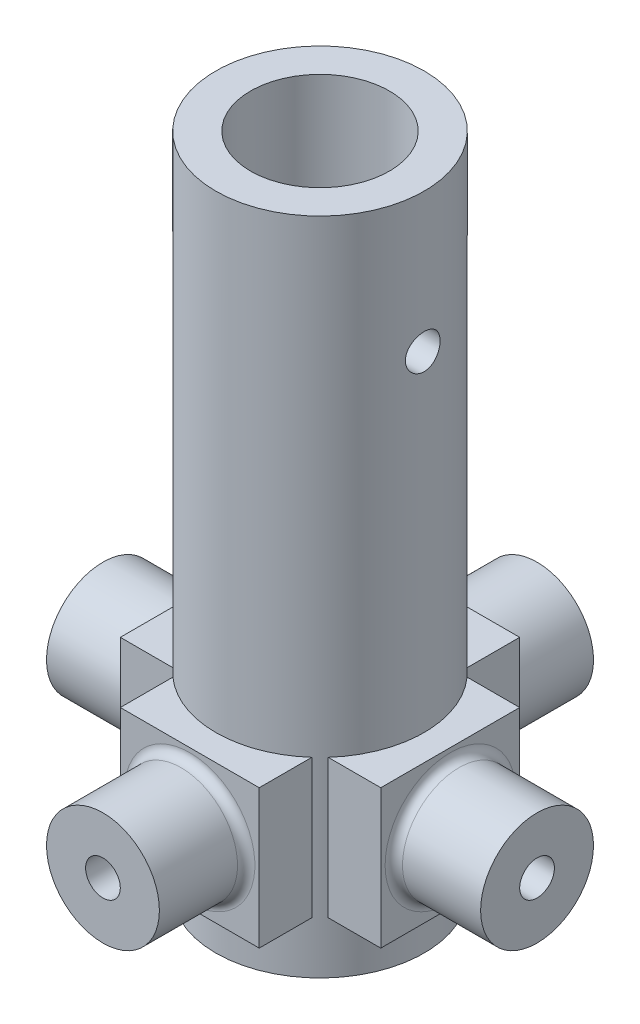
from build123d import *

# Parameters (mm, degrees)
SKETCH1_R           = 60
BOSS_EXTRUDE1_DEPTH = 380
SKETCH2_R           = 40
CUT_EXTRUDE1_DEPTH  = 300
SKETCH3_R           = 10
CUT_EXTRUDE2_DEPTH  = 150
BOSS_EXTRUDE2_START = -30
SKETCH4_W           = 150
SKETCH4_H           = 80
SKETCH4_W_2         = 80
SKETCH4_H_2         = 150
BOSS_EXTRUDE2_DEPTH = 80
SKETCH5_R           = 32.5
SKETCH5_R_2         = 10
BOSS_EXTRUDE3_DEPTH = 50
FILLET1_R           = 5
CIRPATTERN2_COUNT   = 4
FILLET2_R           = 5


with BuildPart() as part:
    # Sketch1 → Boss-Extrude1 (new body)
    with BuildSketch(Plane(origin=(0, 0, 0), x_dir=(1, 0, 0), z_dir=(0, 1, 0))):
        with Locations(Location((0, 0, 0), (0, 0, 270))):
            Circle(SKETCH1_R)
    extrude(amount=BOSS_EXTRUDE1_DEPTH)

    # Sketch2 → Cut-Extrude1 (cut)
    with BuildSketch(Plane(origin=(0, 380, 0), x_dir=(1, 0, 0), z_dir=(0, 1, 0))):
        with Locations(Location((0, 0, 0), (0, 0, 270))):
            Circle(SKETCH2_R)
    extrude(amount=-CUT_EXTRUDE1_DEPTH, mode=Mode.SUBTRACT)

    # Sketch3 → Cut-Extrude2 (cut, symmetric)
    with BuildSketch(Plane(origin=(0, 0, 0), x_dir=(0, 0, -1), z_dir=(1, 0, 0))):
        with Locations((0, 300)):
            Circle(SKETCH3_R)
    extrude(amount=CUT_EXTRUDE2_DEPTH, both=True, mode=Mode.SUBTRACT)

    # Sketch4 → Boss-Extrude2 (add)
    with BuildSketch(Plane.XZ.offset(BOSS_EXTRUDE2_START)):
        Rectangle(SKETCH4_W, SKETCH4_H)
        Rectangle(SKETCH4_W_2, SKETCH4_H_2)
    extrude(amount=-BOSS_EXTRUDE2_DEPTH)

    # Sketch5 → Boss-Extrude3 (add)
    with BuildSketch(Plane.ZY.offset(75)):
        with Locations((0, 70)):
            Circle(SKETCH5_R)
        with Locations((0, 70)):
            Circle(SKETCH5_R_2, mode=Mode.SUBTRACT)
    boss_extrude3 = extrude(amount=BOSS_EXTRUDE3_DEPTH)

    # Fillet1
    fillet1_edges = [part.edges().sort_by_distance(p)[0] for p in [
        (-75, 70, -32.5),
    ]]
    fillet(fillet1_edges, radius=FILLET1_R)

    # CirPattern2: Boss-Extrude3 ×4 about axis
    cirpattern2_axis = Axis((0, 0, 0), (0, 1, 0))
    for i in range(1, CIRPATTERN2_COUNT):
        add(boss_extrude3.rotate(cirpattern2_axis, i * 360 / CIRPATTERN2_COUNT))

    # Fillet2
    fillet2_edges = [part.edges().sort_by_distance(p)[0] for p in [
        (-32.5, 70, 75),
        (75, 70, 32.5),
        (32.5, 70, -75),
    ]]
    fillet(fillet2_edges, radius=FILLET2_R)


solid = part.part
